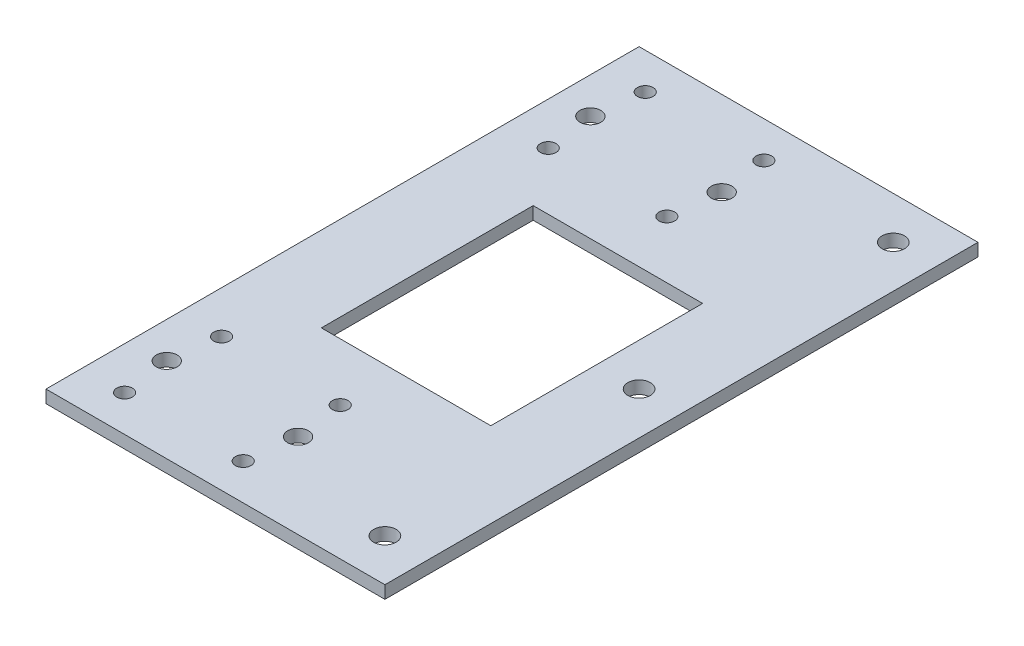
from build123d import *

# Parameters (mm, degrees)
SKETCH_1_R          = 2.5
SKETCH_1_R_2        = 2.45
SKETCH_1_R_3        = 1.85
SKETCH_1_W          = 48
SKETCH_1_H          = 40
EXTRUDE_1_DEPTH     = 3
CUT_EXTRUDE_1_REACH = 82.678
SKETCH_2_W          = 40
SKETCH_2_H          = 50
SKETCH_3_R          = 2.65
CUT_EXTRUDE_2_DEPTH = 10


with BuildPart() as part:
    # 草图1 → 凸台-拉伸1 (new body)
    # profile 1 of 5: a face of its own
    with BuildSketch(Plane(origin=(0, 0, 0), x_dir=(1, 0, 0), z_dir=(0, 1, 0))):
        with BuildLine():
            Line((8, -30), (8, -70))
            Line((8, -70), (40, -70))
            Line((40, -70), (40, 60))
            Line((40, 60), (32.5, 60))
            ThreePointArc((32.5, 60), (28.232233047, 58.232233047), (30, 62.5))
            Line((30, 62.5), (30, 70))
            Line((30, 70), (8, 70))
            Line((8, 70), (8, 30))
            Line((8, 30), (-40, 30))
            Line((-40, 30), (-40, -30))
            Line((-40, -30), (8, -30))
        make_face()
        with Locations(Location((30, -60, 0), (0, 0, 270))):
            Circle(SKETCH_1_R, mode=Mode.SUBTRACT)
        with Locations(Location((30, 0, 0), (0, 0, 270))):
            Circle(SKETCH_1_R, mode=Mode.SUBTRACT)
    # profile 2 of 5: a face of its own
    with BuildSketch(Plane(origin=(0, 0, 0), x_dir=(1, 0, 0), z_dir=(0, 1, 0))):
        with BuildLine():
            Line((32.5, 60), (40, 60))
            Line((40, 60), (40, 70))
            Line((40, 70), (30, 70))
            Line((30, 70), (30, 62.5))
            ThreePointArc((30, 62.5), (31.767766953, 61.767766953), (32.5, 60))
        make_face()
    # profile 3 of 5: a face of its own
    with BuildSketch(Plane(origin=(0, 0, 0), x_dir=(1, 0, 0), z_dir=(0, 1, 0))):
        with BuildLine():
            Line((-40, 61.45), (-40, 30))
            Line((-40, 30), (8, 30))
            Line((8, 30), (8, 70))
            Line((8, 70), (-30, 70))
            Line((-30, 70), (-30, 63.3))
            ThreePointArc((-30, 63.3), (-28.691852455, 62.758147545), (-28.15, 61.45))
            ThreePointArc((-28.15, 61.45), (-30, 59.6), (-31.85, 61.45))
            Line((-31.85, 61.45), (-40, 61.45))
        make_face()
        with Locations(Location((-31.5, 50, 0), (0, 0, 270))):
            Circle(SKETCH_1_R_2, mode=Mode.SUBTRACT)
        with Locations(Location((-30, 38.55, 0), (0, 0, 270))):
            Circle(SKETCH_1_R_3, mode=Mode.SUBTRACT)
        with Locations(Location((-2, 38.55, 0), (0, 0, 270))):
            Circle(SKETCH_1_R_3, mode=Mode.SUBTRACT)
        with Locations(Location((-0.5, 50, 0), (0, 0, 270))):
            Circle(SKETCH_1_R_2, mode=Mode.SUBTRACT)
        with Locations(Location((-2, 61.45, 0), (0, 0, 270))):
            Circle(SKETCH_1_R_3, mode=Mode.SUBTRACT)
    # profile 4 of 5: a face of its own
    with BuildSketch(Plane(origin=(0, 0, 0), x_dir=(1, 0, 0), z_dir=(0, 1, 0))):
        with BuildLine():
            Line((-40, 70), (-40, 61.45))
            Line((-40, 61.45), (-31.85, 61.45))
            ThreePointArc((-31.85, 61.45), (-31.308147545, 62.758147545), (-30, 63.3))
            Line((-30, 63.3), (-30, 70))
            Line((-30, 70), (-40, 70))
        make_face()
    # profile 5 of 5: a face of its own
    with BuildSketch(Plane(origin=(0, 0, 0), x_dir=(1, 0, 0), z_dir=(0, 1, 0))):
        with Locations((-16, -50)):
            Rectangle(SKETCH_1_W, SKETCH_1_H)
        with Locations(Location((-30, -61.45, 0), (0, 0, 270))):
            Circle(SKETCH_1_R_3, mode=Mode.SUBTRACT)
        with Locations(Location((-31.5, -50, 0), (0, 0, 270))):
            Circle(SKETCH_1_R_2, mode=Mode.SUBTRACT)
        with Locations(Location((-30, -38.55, 0), (0, 0, 270))):
            Circle(SKETCH_1_R_3, mode=Mode.SUBTRACT)
        with Locations(Location((-2, -61.45, 0), (0, 0, 270))):
            Circle(SKETCH_1_R_3, mode=Mode.SUBTRACT)
        with Locations(Location((-0.5, -50, 0), (0, 0, 270))):
            Circle(SKETCH_1_R_2, mode=Mode.SUBTRACT)
        with Locations(Location((-2, -38.55, 0), (0, 0, 270))):
            Circle(SKETCH_1_R_3, mode=Mode.SUBTRACT)
    extrude(amount=EXTRUDE_1_DEPTH)

    # 草图2 → 切除-拉伸1 (cut, up to next)
    with BuildSketch(Plane(origin=(0, 3, 0), x_dir=(1, 0, 0), z_dir=(0, 1, 0)), mode=Mode.PRIVATE) as cut_extrude_1_sk1:
        Rectangle(SKETCH_2_W, SKETCH_2_H)
    cut_extrude_1_tool1 = extrude(cut_extrude_1_sk1.sketch, amount=-CUT_EXTRUDE_1_REACH, mode=Mode.PRIVATE) & part.part
    add(cut_extrude_1_tool1.solids().sort_by_distance((0, 3, 0))[0], mode=Mode.SUBTRACT)

    # 草图3 → 切除-拉伸2 (cut)
    with BuildSketch(Plane(origin=(0, 3, 0), x_dir=(1, 0, 0), z_dir=(0, 1, 0))):
        with Locations(Location((30, 60, 0), (0, 0, 270))):
            Circle(SKETCH_3_R)
        with Locations(Location((30, 0, 0), (0, 0, 270))):
            Circle(SKETCH_3_R)
        with Locations(Location((30, -60, 0), (0, 0, 270))):
            Circle(SKETCH_3_R)
    extrude(amount=-CUT_EXTRUDE_2_DEPTH, mode=Mode.SUBTRACT)


solid = part.part
